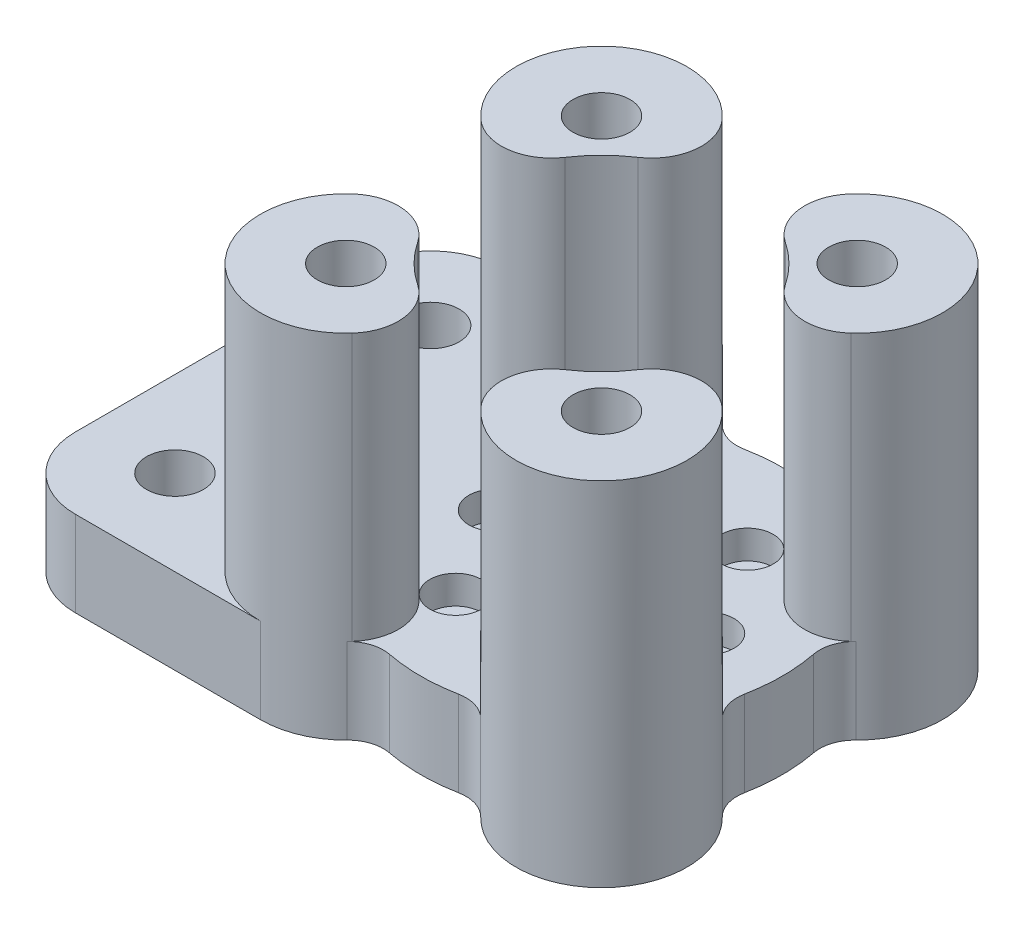
from build123d import *

# Parameters (mm, degrees)
SKETCH1_R                = 4
SKETCH1_R_2              = 10.5
SKETCH1_R_3              = 2
BASE_DEPTH               = 12
SKETCH2_R                = 3.625
BOLT_HEAD_RECESSES_DEPTH = 4
SKETCH3_R                = 4
LEGS_DEPTH               = 37.5
FILLET2_R                = 7
SKETCH4_R                = 7
M8_COUNTERBORE_DEPTH     = 8


with BuildPart() as part:
    # Sketch1 → base (new body)
    with BuildSketch(Plane(origin=(0, 0, 0), x_dir=(1, 0, 0), z_dir=(0, 1, 0))):
        with BuildLine():
            Line((-17.960512242, 29.960512242), (-43.960512242, 29.960512242))
            ThreePointArc((-43.960512242, 29.960512242), (-51.031580054, 27.031580054), (-53.960512242, 19.960512242))
            Line((-53.960512242, 19.960512242), (-53.960512242, -19.960512242))
            ThreePointArc((-53.960512242, -19.960512242), (-51.031580054, -27.031580054), (-43.960512242, -29.960512242))
            Line((-43.960512242, -29.960512242), (-17.960512242, -29.960512242))
            ThreePointArc((-17.960512242, -29.960512242), (-13.304198931, -29.020292816), (-9.377544991, -26.346969967))
            ThreePointArc((-9.377544991, -26.346969967), (-7.290769599, -25.068329757), (-4.847146031, -24.9332143))
            ThreePointArc((-4.847146031, -24.9332143), (0, -25.4), (4.847146031, -24.9332143))
            ThreePointArc((4.847146031, -24.9332143), (7.290769599, -25.068329757), (9.377544991, -26.346969967))
            ThreePointArc((9.377544991, -26.346969967), (26.445793616, -26.445793616), (26.346969967, -9.377544991))
            ThreePointArc((26.346969967, -9.377544991), (25.068329757, -7.290769599), (24.9332143, -4.847146031))
            ThreePointArc((24.9332143, -4.847146031), (25.4, 0), (24.9332143, 4.847146031))
            ThreePointArc((24.9332143, 4.847146031), (25.068329757, 7.290769599), (26.346969967, 9.377544991))
            ThreePointArc((26.346969967, 9.377544991), (26.445793616, 26.445793616), (9.377544991, 26.346969967))
            ThreePointArc((9.377544991, 26.346969967), (7.290769599, 25.068329757), (4.847146031, 24.9332143))
            ThreePointArc((4.847146031, 24.9332143), (0, 25.4), (-4.847146031, 24.9332143))
            ThreePointArc((-4.847146031, 24.9332143), (-7.290769599, 25.068329757), (-9.377544991, 26.346969967))
            ThreePointArc((-9.377544991, 26.346969967), (-13.304198931, 29.020292816), (-17.960512242, 29.960512242))
        make_face()
        with Locations(Location((-17.960512242, 17.960512242, 0), (0, 0, 270))):
            Circle(SKETCH1_R, mode=Mode.SUBTRACT)
        with Locations(Location((17.960512242, 17.960512242, 0), (0, 0, 270))):
            Circle(SKETCH1_R, mode=Mode.SUBTRACT)
        with Locations(Location((17.960512242, -17.960512242, 0), (0, 0, 270))):
            Circle(SKETCH1_R, mode=Mode.SUBTRACT)
        with Locations(Location((-17.960512242, -17.960512242, 0), (0, 0, 270))):
            Circle(SKETCH1_R, mode=Mode.SUBTRACT)
        with Locations(Location((0, 0, 0), (0, 0, 270))):
            Circle(SKETCH1_R_2, mode=Mode.SUBTRACT)
        with Locations(Location((-7.5, 12.990381057, 0), (0, 0, 270))):
            Circle(SKETCH1_R_3, mode=Mode.SUBTRACT)
        with Locations(Location((7.5, 12.990381057, 0), (0, 0, 270))):
            Circle(SKETCH1_R_3, mode=Mode.SUBTRACT)
        with Locations(Location((15, 0, 0), (0, 0, 270))):
            Circle(SKETCH1_R_3, mode=Mode.SUBTRACT)
        with Locations(Location((7.5, -12.990381057, 0), (0, 0, 270))):
            Circle(SKETCH1_R_3, mode=Mode.SUBTRACT)
        with Locations(Location((-7.5, -12.990381057, 0), (0, 0, 270))):
            Circle(SKETCH1_R_3, mode=Mode.SUBTRACT)
        with Locations(Location((-15, 0, 0), (0, 0, 270))):
            Circle(SKETCH1_R_3, mode=Mode.SUBTRACT)
        with Locations(Location((-41.960512242, 17.960512242, 0), (0, 0, 270))):
            Circle(SKETCH1_R, mode=Mode.SUBTRACT)
        with Locations(Location((-41.960512242, -17.960512242, 0), (0, 0, 270))):
            Circle(SKETCH1_R, mode=Mode.SUBTRACT)
    extrude(amount=BASE_DEPTH)

    # Sketch2 → bolt head recesses (cut)
    with BuildSketch(Plane(origin=(0, 12, 0), x_dir=(1, 0, 0), z_dir=(0, 1, 0))):
        with Locations(Location((-7.5, 12.990381057, 0), (0, 0, 270))):
            Circle(SKETCH2_R)
        with Locations(Location((7.5, 12.990381057, 0), (0, 0, 270))):
            Circle(SKETCH2_R)
        with Locations(Location((15, 0, 0), (0, 0, 270))):
            Circle(SKETCH2_R)
        with Locations(Location((7.5, -12.990381057, 0), (0, 0, 270))):
            Circle(SKETCH2_R)
        with Locations(Location((-7.5, -12.990381057, 0), (0, 0, 270))):
            Circle(SKETCH2_R)
        with Locations(Location((-15, 0, 0), (0, 0, 270))):
            Circle(SKETCH2_R)
    extrude(amount=-BOLT_HEAD_RECESSES_DEPTH, mode=Mode.SUBTRACT)

    # Sketch3 → legs (add)
    # profile 1 of 4: a face of its own
    with BuildSketch(Plane(origin=(0, 12, 0), x_dir=(1, 0, 0), z_dir=(0, 1, 0))):
        with BuildLine():
            ThreePointArc((-17.64406852, -5.964685327), (-26.445793616, -26.445793616), (-5.964685327, -17.64406852))
            ThreePointArc((-5.964685327, -17.64406852), (-13.1698638, -13.1698638), (-17.64406852, -5.964685327))
        make_face()
        with Locations(Location((-17.960512242, -17.960512242, 0), (0, 0, 270))):
            Circle(SKETCH3_R, mode=Mode.SUBTRACT)
    # profile 2 of 4: a face of its own
    with BuildSketch(Plane(origin=(0, 12, 0), x_dir=(1, 0, 0), z_dir=(0, 1, 0))):
        with BuildLine():
            ThreePointArc((-5.964685327, 17.64406852), (-26.445793616, 26.445793616), (-17.64406852, 5.964685327))
            ThreePointArc((-17.64406852, 5.964685327), (-13.1698638, 13.1698638), (-5.964685327, 17.64406852))
        make_face()
        with Locations(Location((-17.960512242, 17.960512242, 0), (0, 0, 270))):
            Circle(SKETCH3_R, mode=Mode.SUBTRACT)
    # profile 3 of 4: a face of its own
    with BuildSketch(Plane(origin=(0, 12, 0), x_dir=(1, 0, 0), z_dir=(0, 1, 0))):
        with BuildLine():
            ThreePointArc((17.64406852, 5.964685327), (26.445793616, 26.445793616), (5.964685327, 17.64406852))
            ThreePointArc((5.964685327, 17.64406852), (13.1698638, 13.1698638), (17.64406852, 5.964685327))
        make_face()
        with Locations(Location((17.960512242, 17.960512242, 0), (0, 0, 270))):
            Circle(SKETCH3_R, mode=Mode.SUBTRACT)
    # profile 4 of 4: a face of its own
    with BuildSketch(Plane(origin=(0, 12, 0), x_dir=(1, 0, 0), z_dir=(0, 1, 0))):
        with BuildLine():
            ThreePointArc((5.964685327, -17.64406852), (26.445793616, -26.445793616), (17.64406852, -5.964685327))
            ThreePointArc((17.64406852, -5.964685327), (13.1698638, -13.1698638), (5.964685327, -17.64406852))
        make_face()
        with Locations(Location((17.960512242, -17.960512242, 0), (0, 0, 270))):
            Circle(SKETCH3_R, mode=Mode.SUBTRACT)
    extrude(amount=LEGS_DEPTH)

    # Fillet2
    fillet2_edges = [part.edges().sort_by_distance(p)[0] for p in [
        (-17.64406852, 30.75, -5.964685327),
        (-5.964685327, 30.75, -17.64406852),
        (5.964685327, 30.75, -17.64406852),
        (17.64406852, 30.75, -5.964685327),
        (17.64406852, 30.75, 5.964685327),
        (5.964685327, 30.75, 17.64406852),
        (-5.964685327, 30.75, 17.64406852),
        (-17.64406852, 30.75, 5.964685327),
    ]]
    fillet(fillet2_edges, radius=FILLET2_R)

    # Sketch4 → m8 counterbore (cut)
    with BuildSketch(Plane.XZ):
        with Locations(Location((17.960512242, 17.960512242, 0), (0, 0, 270))):
            Circle(SKETCH4_R)
        with Locations(Location((17.960512242, -17.960512242, 0), (0, 0, 270))):
            Circle(SKETCH4_R)
        with Locations(Location((-17.960512242, -17.960512242, 0), (0, 0, 270))):
            Circle(SKETCH4_R)
        with Locations(Location((-17.960512242, 17.960512242, 0), (0, 0, 270))):
            Circle(SKETCH4_R)
    extrude(amount=-M8_COUNTERBORE_DEPTH, mode=Mode.SUBTRACT)


solid = part.part
